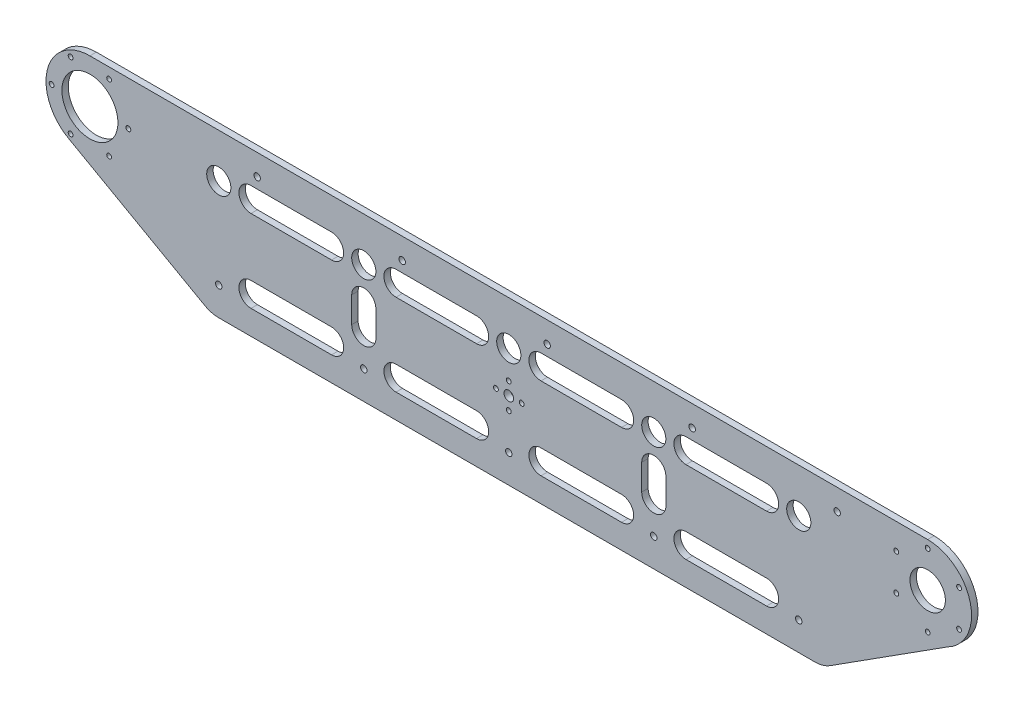
from build123d import *

# Parameters (mm, degrees)
CROQUIS2_R              = 2
CROQUIS2_R_2            = 7.5
CROQUIS2_R_3            = 17.4
CROQUIS2_R_4            = 11
CROQUIS2_R_5            = 1.5
CROQUIS2_R_6            = 3
SALIENTE_EXTRUIR1_DEPTH = 4


with BuildPart() as part:
    # Croquis2 → Saliente-Extruir1 (new body)
    with BuildSketch(Plane.XY):
        with BuildLine():
            Line((-179.195612521, -41.480204958), (179.195612521, -41.480204958))
            Line((179.195612521, -41.480204958), (190.010789857, -41.480204958))
            ThreePointArc((190.010789857, -41.480204958), (194.944809403, -40.774865591), (199.483580997, -38.715349889))
            Line((199.483580997, -38.715349889), (272.742664287, 8.031785175))
            ThreePointArc((272.742664287, 8.031785175), (286.437106864, 38.672371901), (260, 59.347542834))
            Line((260, 59.347542834), (-260, 59.347542834))
            ThreePointArc((-260, 59.347542834), (-286.437106864, 38.672371901), (-272.742664287, 8.031785175))
            Line((-272.742664287, 8.031785175), (-188.625622076, -39.240895373))
            ThreePointArc((-188.625622076, -39.240895373), (-184.06774563, -41.022236998), (-179.195612521, -41.480204958))
        make_face()
        with Locations((0, -23.892457166)):
            Circle(CROQUIS2_R, mode=Mode.SUBTRACT)
        with Locations((-90, -23.892457166)):
            Circle(CROQUIS2_R, mode=Mode.SUBTRACT)
        with Locations((-180, -23.892457166)):
            Circle(CROQUIS2_R, mode=Mode.SUBTRACT)
        with Locations((-90, 32.107542834)):
            Circle(CROQUIS2_R_2, mode=Mode.SUBTRACT)
        with Locations((0, 32.107542834)):
            Circle(CROQUIS2_R_2, mode=Mode.SUBTRACT)
        with Locations((-260, 32.107542834)):
            Circle(CROQUIS2_R_3, mode=Mode.SUBTRACT)
        with Locations(Location((260, 32.107542834, 0), (0, 0, 180))):
            Circle(CROQUIS2_R_4, mode=Mode.SUBTRACT)
        with Locations(Location((90, 32.107542834, 0), (0, 0, 180))):
            Circle(CROQUIS2_R_2, mode=Mode.SUBTRACT)
        with Locations(Location((90, -23.892457166, 0), (0, 0, 180))):
            Circle(CROQUIS2_R, mode=Mode.SUBTRACT)
        with Locations(Location((-180, 32.107542834, 0), (0, 0, 180))):
            Circle(CROQUIS2_R_2, mode=Mode.SUBTRACT)
        with Locations((180, 32.107542834)):
            Circle(CROQUIS2_R_2, mode=Mode.SUBTRACT)
        with Locations((-8, 6.607542834)):
            Circle(CROQUIS2_R_5, mode=Mode.SUBTRACT)
        with Locations((0, 14.607542834)):
            Circle(CROQUIS2_R_5, mode=Mode.SUBTRACT)
        with Locations((8, 6.607542834)):
            Circle(CROQUIS2_R_5, mode=Mode.SUBTRACT)
        with Locations((0, -1.392457166)):
            Circle(CROQUIS2_R_5, mode=Mode.SUBTRACT)
        with Locations((0, 6.607542834)):
            Circle(CROQUIS2_R_6, mode=Mode.SUBTRACT)
        with Locations((180, -23.892457166)):
            Circle(CROQUIS2_R, mode=Mode.SUBTRACT)
        with Locations((260, 9.607542834)):
            Circle(CROQUIS2_R_5, mode=Mode.SUBTRACT)
        with Locations((279.485571585, 20.857542834)):
            Circle(CROQUIS2_R_5, mode=Mode.SUBTRACT)
        with Locations((279.485571585, 43.357542834)):
            Circle(CROQUIS2_R_5, mode=Mode.SUBTRACT)
        with Locations((260, 54.607542834)):
            Circle(CROQUIS2_R_5, mode=Mode.SUBTRACT)
        with Locations((240.514428415, 43.357542834)):
            Circle(CROQUIS2_R_5, mode=Mode.SUBTRACT)
        with Locations((240.514428415, 20.857542834)):
            Circle(CROQUIS2_R_5, mode=Mode.SUBTRACT)
        with Locations((203.834428415, 46.217542834)):
            Circle(CROQUIS2_R, mode=Mode.SUBTRACT)
        with Locations((113.834428415, 46.217542834)):
            Circle(CROQUIS2_R, mode=Mode.SUBTRACT)
        with Locations((23.834428415, 46.217542834)):
            Circle(CROQUIS2_R, mode=Mode.SUBTRACT)
        with Locations((-66.165571585, 46.217542834)):
            Circle(CROQUIS2_R, mode=Mode.SUBTRACT)
        with Locations((-156.165571585, 46.217542834)):
            Circle(CROQUIS2_R, mode=Mode.SUBTRACT)
        with Locations((-248.05, 11.409535684)):
            Circle(CROQUIS2_R_5, mode=Mode.SUBTRACT)
        with Locations((-236.1, 32.107542834)):
            Circle(CROQUIS2_R_5, mode=Mode.SUBTRACT)
        with Locations((-248.05, 52.805549985)):
            Circle(CROQUIS2_R_5, mode=Mode.SUBTRACT)
        with Locations((-271.95, 52.805549985)):
            Circle(CROQUIS2_R_5, mode=Mode.SUBTRACT)
        with Locations((-283.74, 32.107542834)):
            Circle(CROQUIS2_R_5, mode=Mode.SUBTRACT)
        with Locations((-271.95, 11.409535684)):
            Circle(CROQUIS2_R_5, mode=Mode.SUBTRACT)
        with BuildLine():
            Line((-82.5, 12.107542834), (-82.5, -3.892457166))
            ThreePointArc((-82.5, -3.892457166), (-90, -11.392457166), (-97.5, -3.892457166))
            Line((-97.5, -3.892457166), (-97.5, 12.107542834))
            ThreePointArc((-97.5, 12.107542834), (-90, 19.607542834), (-82.5, 12.107542834))
        make_face(mode=Mode.SUBTRACT)
        with BuildLine():
            Line((-20, 24.607542834), (-70, 24.607542834))
            ThreePointArc((-70, 24.607542834), (-77.5, 32.107542834), (-70, 39.607542834))
            Line((-70, 39.607542834), (-20, 39.607542834))
            ThreePointArc((-20, 39.607542834), (-12.5, 32.107542834), (-20, 24.607542834))
        make_face(mode=Mode.SUBTRACT)
        with BuildLine():
            Line((160, -26.392457166), (110, -26.392457166))
            ThreePointArc((110, -26.392457166), (102.5, -18.892457166), (110, -11.392457166))
            Line((110, -11.392457166), (160, -11.392457166))
            ThreePointArc((160, -11.392457166), (167.5, -18.892457166), (160, -26.392457166))
        make_face(mode=Mode.SUBTRACT)
        with BuildLine():
            Line((20, -11.392457166), (70, -11.392457166))
            ThreePointArc((70, -11.392457166), (77.5, -18.892457166), (70, -26.392457166))
            Line((70, -26.392457166), (20, -26.392457166))
            ThreePointArc((20, -26.392457166), (12.5, -18.892457166), (20, -11.392457166))
        make_face(mode=Mode.SUBTRACT)
        with BuildLine():
            Line((20, 39.607542834), (70, 39.607542834))
            ThreePointArc((70, 39.607542834), (77.5, 32.107542834), (70, 24.607542834))
            Line((70, 24.607542834), (20, 24.607542834))
            ThreePointArc((20, 24.607542834), (12.5, 32.107542834), (20, 39.607542834))
        make_face(mode=Mode.SUBTRACT)
        with BuildLine():
            Line((-160, 39.607542834), (-110, 39.607542834))
            ThreePointArc((-110, 39.607542834), (-102.5, 32.107542834), (-110, 24.607542834))
            Line((-110, 24.607542834), (-160, 24.607542834))
            ThreePointArc((-160, 24.607542834), (-167.5, 32.107542834), (-160, 39.607542834))
        make_face(mode=Mode.SUBTRACT)
        with BuildLine():
            Line((-20, -26.392457166), (-70, -26.392457166))
            ThreePointArc((-70, -26.392457166), (-77.5, -18.892457166), (-70, -11.392457166))
            Line((-70, -11.392457166), (-20, -11.392457166))
            ThreePointArc((-20, -11.392457166), (-12.5, -18.892457166), (-20, -26.392457166))
        make_face(mode=Mode.SUBTRACT)
        with BuildLine():
            Line((160, 24.607542834), (110, 24.607542834))
            ThreePointArc((110, 24.607542834), (102.5, 32.107542834), (110, 39.607542834))
            Line((110, 39.607542834), (160, 39.607542834))
            ThreePointArc((160, 39.607542834), (167.5, 32.107542834), (160, 24.607542834))
        make_face(mode=Mode.SUBTRACT)
        with BuildLine():
            Line((-160, -26.392457166), (-110, -26.392457166))
            ThreePointArc((-110, -26.392457166), (-102.5, -18.892457166), (-110, -11.392457166))
            Line((-110, -11.392457166), (-160, -11.392457166))
            ThreePointArc((-160, -11.392457166), (-167.5, -18.892457166), (-160, -26.392457166))
        make_face(mode=Mode.SUBTRACT)
        with BuildLine():
            Line((97.5, 12.107542834), (97.5, -3.892457166))
            ThreePointArc((97.5, -3.892457166), (90, -11.392457166), (82.5, -3.892457166))
            Line((82.5, -3.892457166), (82.5, 12.107542834))
            ThreePointArc((82.5, 12.107542834), (90, 19.607542834), (97.5, 12.107542834))
        make_face(mode=Mode.SUBTRACT)
    extrude(amount=SALIENTE_EXTRUIR1_DEPTH)


solid = part.part
